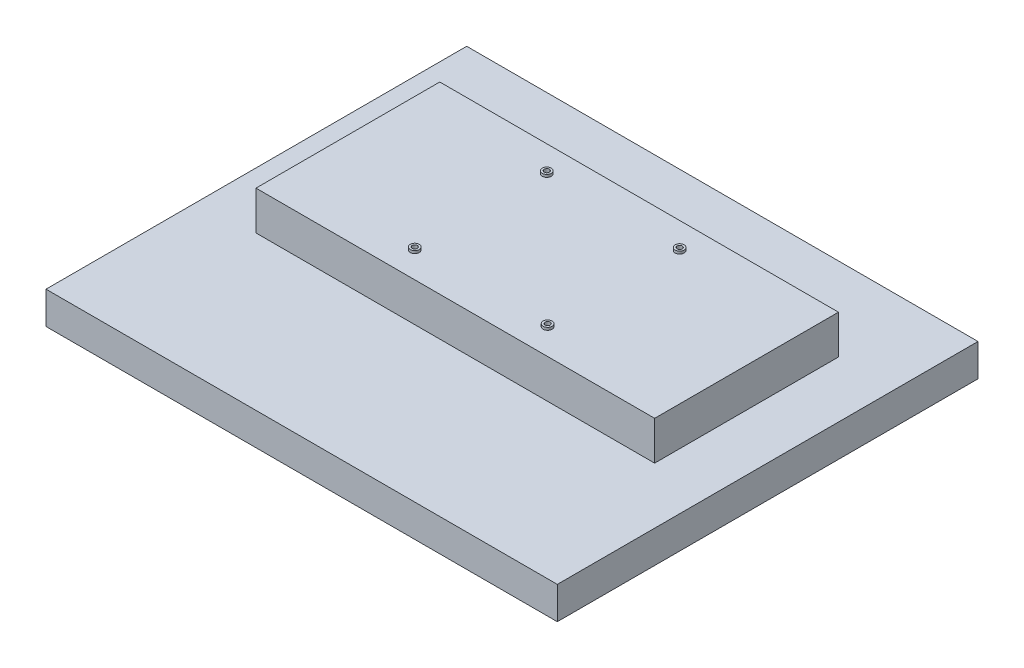
from build123d import *

# Parameters (mm, degrees)
SKETCH1_W           = 395
SKETCH1_H           = 325
BOSS_EXTRUDE1_DEPTH = 25
SKETCH2_W           = 380
SKETCH2_H           = 305
CUT_EXTRUDE1_DEPTH  = 0.8
SKETCH3_W           = 308
SKETCH3_H           = 142
SKETCH3_R           = 3.5
BOSS_EXTRUDE3_DEPTH = 30
SKETCH3_3_R         = 3.5
BOSS_EXTRUDE4_DEPTH = 32
SKETCH4_R           = 2
CUT_EXTRUDE2_DEPTH  = 10


with BuildPart() as part:
    # Sketch1 → Boss-Extrude1 (new body)
    with BuildSketch(Plane(origin=(0, 0, 0), x_dir=(1, 0, 0), z_dir=(0, 1, 0))):
        Rectangle(SKETCH1_W, SKETCH1_H)
    extrude(amount=BOSS_EXTRUDE1_DEPTH)

    # Sketch2 → Cut-Extrude1 (cut)
    with BuildSketch(Plane.XZ):
        Rectangle(SKETCH2_W, SKETCH2_H)
    extrude(amount=-CUT_EXTRUDE1_DEPTH, mode=Mode.SUBTRACT)

    # Sketch3 → Boss-Extrude3 (add)
    with BuildSketch(Plane(origin=(0, 25, 0), x_dir=(1, 0, 0), z_dir=(0, 1, 0))):
        with Locations((0, 27.2)):
            Rectangle(SKETCH3_W, SKETCH3_H)
        with Locations((-51.333333333, -23.8)):
            Circle(SKETCH3_R, mode=Mode.SUBTRACT)
        with Locations((51.333333333, -23.8)):
            Circle(SKETCH3_R, mode=Mode.SUBTRACT)
        with Locations((-51.333333333, 78.2)):
            Circle(SKETCH3_R, mode=Mode.SUBTRACT)
        with Locations((51.333333333, 78.2)):
            Circle(SKETCH3_R, mode=Mode.SUBTRACT)
    extrude(amount=BOSS_EXTRUDE3_DEPTH)

    # Sketch3<3> → Boss-Extrude4 (add)
    with BuildSketch(Plane(origin=(0, 25, 0), x_dir=(1, 0, 0), z_dir=(0, 1, 0))):
        with Locations((-51.333333333, 78.2)):
            Circle(SKETCH3_3_R)
        with Locations((51.333333333, 78.2)):
            Circle(SKETCH3_3_R)
        with Locations((51.333333333, -23.8)):
            Circle(SKETCH3_3_R)
        with Locations((-51.333333333, -23.8)):
            Circle(SKETCH3_3_R)
    extrude(amount=BOSS_EXTRUDE4_DEPTH)

    # Sketch4 → Cut-Extrude2 (cut)
    with BuildSketch(Plane(origin=(0, 57, 0), x_dir=(1, 0, 0), z_dir=(0, 1, 0))):
        with Locations((-51.333333333, 78.2)):
            Circle(SKETCH4_R)
        with Locations((51.333333333, 78.2)):
            Circle(SKETCH4_R)
        with Locations((-51.333333333, -23.8)):
            Circle(SKETCH4_R)
        with Locations((51.333333333, -23.8)):
            Circle(SKETCH4_R)
    extrude(amount=-CUT_EXTRUDE2_DEPTH, mode=Mode.SUBTRACT)


solid = part.part
